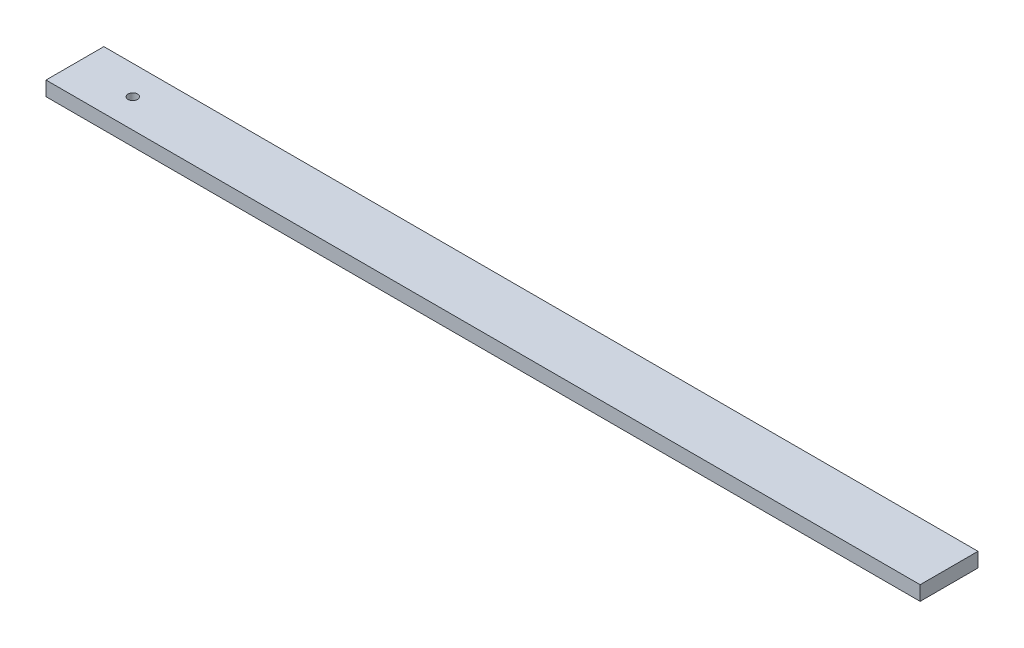
from build123d import *

# Parameters (mm, degrees)
SKETCH2_W           = 383.75
SKETCH2_H           = 25.4
BOSS_EXTRUDE1_DEPTH = 6.35
SKETCH3_R           = 2.0828
CUT_EXTRUDE1_DEPTH  = 6.35


with BuildPart() as part:
    # Sketch2 → Boss-Extrude1 (new body)
    with BuildSketch(Plane(origin=(0, 0, 0), x_dir=(1, 0, 0), z_dir=(0, 1, 0))):
        with Locations((191.875, 12.7)):
            Rectangle(SKETCH2_W, SKETCH2_H)
    extrude(amount=BOSS_EXTRUDE1_DEPTH)

    # Sketch3 → Cut-Extrude1 (cut)
    with BuildSketch(Plane(origin=(0, 6.35, 0), x_dir=(1, 0, 0), z_dir=(0, 1, 0))):
        with Locations(Location((25.4, 12.7, 0), (0, 0, 270))):
            Circle(SKETCH3_R)
    extrude(amount=-CUT_EXTRUDE1_DEPTH, mode=Mode.SUBTRACT)


solid = part.part
